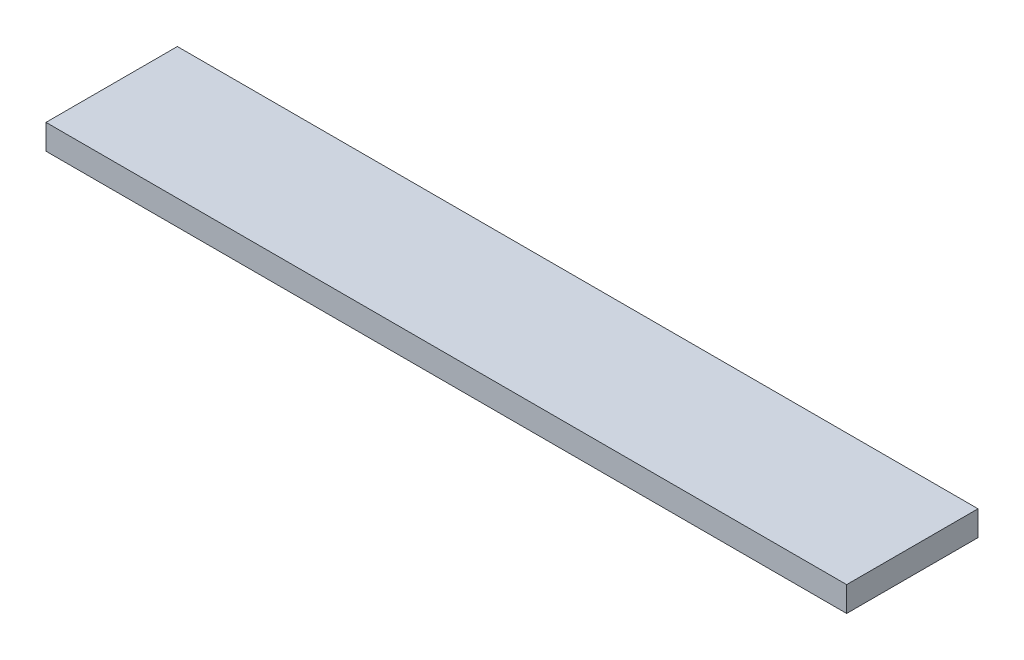
from build123d import *

# Parameters (mm, degrees)
SKETCH1_W           = 128
SKETCH1_H           = 21
BOSS_EXTRUDE1_DEPTH = 4


with BuildPart() as part:
    # Sketch1 → Boss-Extrude1 (new body)
    with BuildSketch(Plane(origin=(0, 0, 0), x_dir=(1, 0, 0), z_dir=(0, 1, 0))):
        Rectangle(SKETCH1_W, SKETCH1_H)
    extrude(amount=BOSS_EXTRUDE1_DEPTH)


solid = part.part
